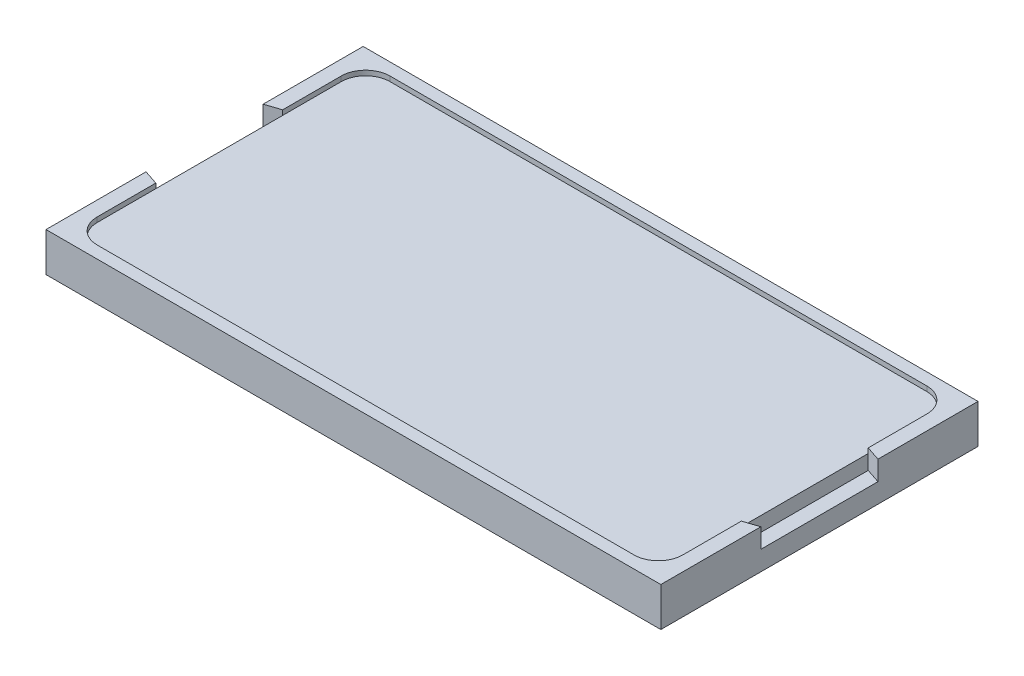
from build123d import *

# Parameters (mm, degrees)
SKETCH5_W           = 1600.2
SKETCH5_H           = 825.5
BOSS_EXTRUDE1_DEPTH = 101.6
SKETCH6_W           = 1524
SKETCH6_H           = 762
CUT_EXTRUDE1_DEPTH  = 12.7
CUT_EXTRUDE2_DEPTH  = 50.8
CUT_EXTRUDE3_DEPTH  = 50.8
BOSS_EXTRUDE4_DEPTH = 12.7


with BuildPart() as part:
    # Sketch5 → Boss-Extrude1 (new body)
    with BuildSketch(Plane(origin=(0, 0, 0), x_dir=(1, 0, 0), z_dir=(0, 1, 0))):
        Rectangle(SKETCH5_W, SKETCH5_H)
    extrude(amount=BOSS_EXTRUDE1_DEPTH)

    # Sketch6 → Cut-Extrude1 (cut)
    with BuildSketch(Plane(origin=(0, 101.6, 0), x_dir=(1, 0, 0), z_dir=(0, 1, 0))):
        Rectangle(SKETCH6_W, SKETCH6_H)
    extrude(amount=-CUT_EXTRUDE1_DEPTH, mode=Mode.SUBTRACT)

    # Sketch10 → Cut-Extrude2 (cut)
    with BuildSketch(Plane(origin=(0, 101.6, 0), x_dir=(1, 0, 0), z_dir=(0, 1, 0))):
        Polygon((800.1, -152.4), (800.1, 0), (800.1, 152.4), (762, 165.1), (762, 0), (762, -165.1), align=None)
    extrude(amount=-CUT_EXTRUDE2_DEPTH, mode=Mode.SUBTRACT)

    # Sketch12 → Cut-Extrude3 (cut)
    with BuildSketch(Plane(origin=(0, 101.6, 0), x_dir=(1, 0, 0), z_dir=(0, 1, 0))):
        Polygon((-800.1, 0), (-800.1, 152.4), (-762, 165.1), (-762, 0), (-762, -165.1), (-800.1, -152.4), align=None)
    extrude(amount=-CUT_EXTRUDE3_DEPTH, mode=Mode.SUBTRACT)

    # Sketch16 → Boss-Extrude4 (add)
    with BuildSketch(Plane(origin=(0, 88.9, 0), x_dir=(1, 0, 0), z_dir=(0, 1, 0))):
        with BuildLine():
            Line((762, 381), (762, 317.5))
            ThreePointArc((762, 317.5), (743.401280605, 362.401280605), (698.5, 381))
            Line((698.5, 381), (762, 381))
        make_face()
        with BuildLine():
            Line((-762, 317.5), (-762, 381))
            Line((-762, 381), (-698.5, 381))
            ThreePointArc((-698.5, 381), (-743.401280605, 362.401280605), (-762, 317.5))
        make_face()
        with BuildLine():
            Line((-698.5, -381), (-762, -381))
            Line((-762, -381), (-762, -317.5))
            ThreePointArc((-762, -317.5), (-743.401280605, -362.401280605), (-698.5, -381))
        make_face()
        with BuildLine():
            Line((698.5, -381), (762, -381))
            Line((762, -381), (762, -317.5))
            ThreePointArc((762, -317.5), (743.401280605, -362.401280605), (698.5, -381))
        make_face()
    extrude(amount=BOSS_EXTRUDE4_DEPTH)


solid = part.part
